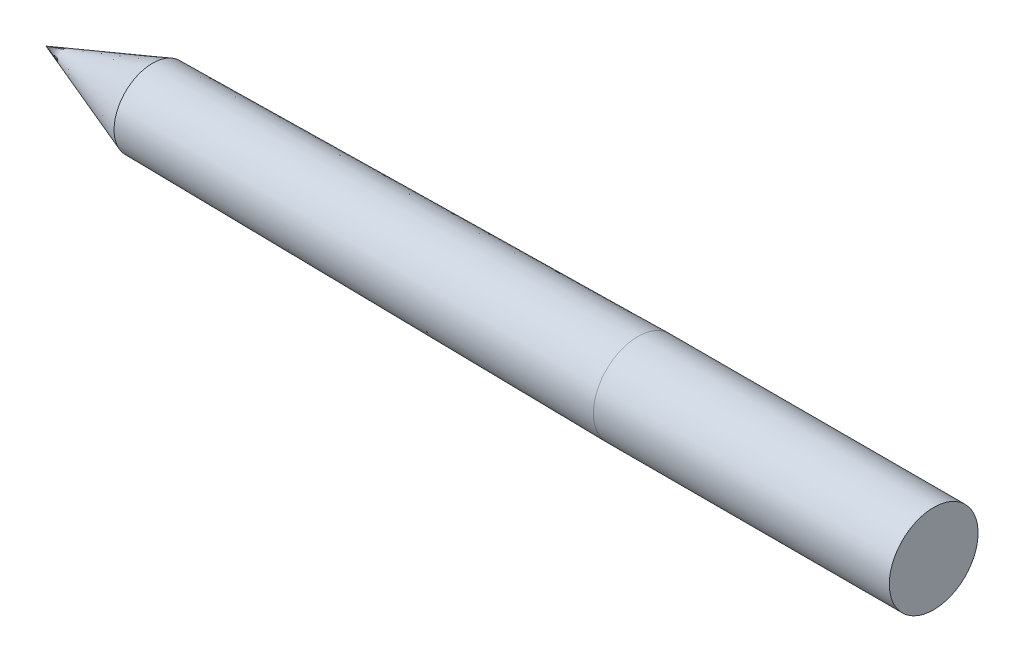
from build123d import *


with BuildPart() as part:
    # Sketch1 → Revolve1 (revolve)
    with BuildSketch(Plane.XY, mode=Mode.PRIVATE) as revolve1_sk:
        Polygon((0, 0), (20, 0), (30, 0), (30, 1.5), (20, 1.5), (3.6, 1.3), align=None)
    revolve(revolve1_sk.sketch.rotate(Axis((0, 0, 0), (1, 0, 0)), 90), axis=Axis((0, 0, 0), (1, 0, 0)))


solid = part.part
